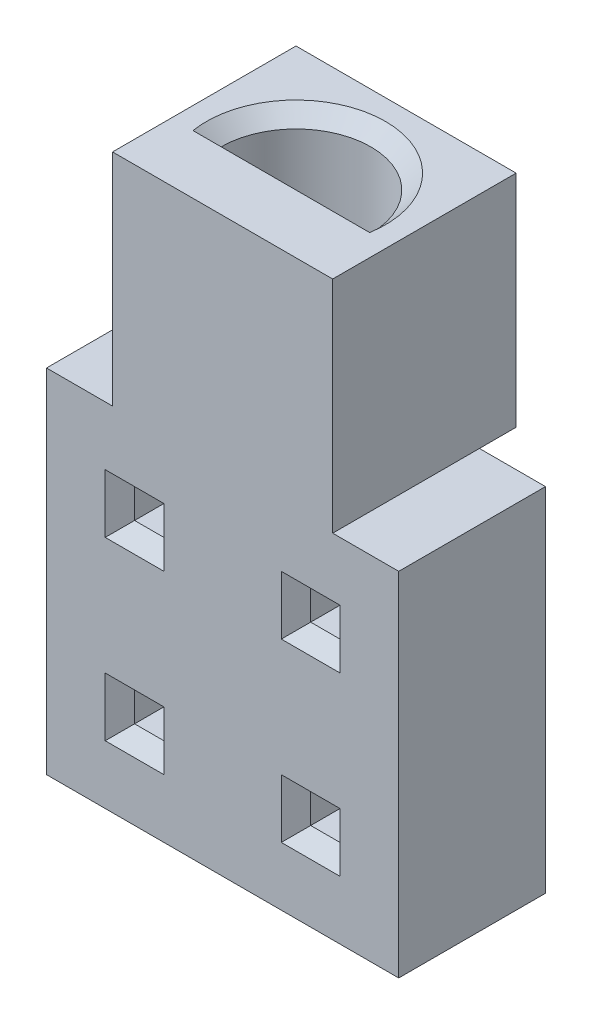
from build123d import *

# Parameters (mm, degrees)
AUFSATZ_LINEAR_AUSTRAGEN1_DEPTH      = 5
AUFSATZ_LINEAR_AUSTRAGEN1_DEPTH_BACK = 5
SKIZZE1_W                            = 24
SKIZZE1_H                            = 24
SKIZZE3_W                            = 15
SKIZZE3_H                            = 15
AUFSATZ_LINEAR_AUSTRAGEN2_DEPTH      = 15
SCHNITT_LINEAR_AUSTRAGEN1_DEPTH      = 10
FASE1_SIZE                           = 1
SCHNITT_LINEAR_START                 = -11
SKIZZE6_W                            = 2
SKIZZE6_H                            = 2
SCHNITT_LINEAR_AUSTRAGEN2_DEPTH      = 12
FASE2_SIZE                           = 1
SKIZZE12_W                           = 15
SKIZZE12_H                           = 15
SCHNITT_LINEAR_AUSTRAGEN4_DEPTH      = 2.5


with BuildPart() as part:
    # Skizze1 → Aufsatz-Linear austragen1 (new, two sides: drawn at the far end of the back side and taken through both)
    with BuildSketch(Plane.XY.offset(-AUFSATZ_LINEAR_AUSTRAGEN1_DEPTH_BACK)):
        Rectangle(SKIZZE1_W, SKIZZE1_H)
    extrude(amount=AUFSATZ_LINEAR_AUSTRAGEN1_DEPTH + AUFSATZ_LINEAR_AUSTRAGEN1_DEPTH_BACK)

    # Skizze3 → Aufsatz-Linear austragen2 (add)
    with BuildSketch(Plane(origin=(0, 12, 0), x_dir=(1, 0, 0), z_dir=(0, 1, 0))):
        Rectangle(SKIZZE3_W, SKIZZE3_H)
    extrude(amount=AUFSATZ_LINEAR_AUSTRAGEN2_DEPTH)

    # Skizze5 → Schnitt-Linear austragen1 (cut)
    with BuildSketch(Plane(origin=(0, 27, 0), x_dir=(1, 0, 0), z_dir=(0, 1, 0))):
        with BuildLine():
            Line((-5.1, 0), (5.1, 0))
            ThreePointArc((5.1, 0), (0, 5.1), (-5.1, 0))
        make_face()
    extrude(amount=-SCHNITT_LINEAR_AUSTRAGEN1_DEPTH, mode=Mode.SUBTRACT)

    # Fase1
    fase1_edges = [part.edges().sort_by_distance(p)[0] for p in [
        (0, 27, -5.1),
        (0, 27, 0),
    ]]
    chamfer(fase1_edges, length=FASE1_SIZE)

    # Skizze6 → Schnitt-Linear austragen2 (cut)
    with BuildSketch(Plane.XY.offset(-3).offset(SCHNITT_LINEAR_START)):
        with Locations((6, 6)):
            Rectangle(SKIZZE6_W, SKIZZE6_H)
        with Locations((6, -6)):
            Rectangle(SKIZZE6_W, SKIZZE6_H)
        with Locations((-6, -6)):
            Rectangle(SKIZZE6_W, SKIZZE6_H)
        with Locations((-6, 6)):
            Rectangle(SKIZZE6_W, SKIZZE6_H)
    schnitt_linear_austragen2 = extrude(amount=SCHNITT_LINEAR_AUSTRAGEN2_DEPTH, mode=Mode.SUBTRACT)

    # Spiegeln1: Schnitt-Linear austragen2 across plane
    add(schnitt_linear_austragen2.mirror(Plane.XY), mode=Mode.SUBTRACT)

    # Fase2
    fase2_edges = [part.edges().sort_by_distance(p)[0] for p in [
        (6, 5, 5),
        (7, 6, 5),
        (6, 7, 5),
        (5, 6, 5),
        (6, -7, 5),
        (7, -6, 5),
        (6, -5, 5),
        (5, -6, 5),
        (-6, -7, 5),
        (-5, -6, 5),
        (-6, -5, 5),
        (-7, -6, 5),
        (-6, 5, 5),
        (-5, 6, 5),
        (-6, 7, 5),
        (-7, 6, 5),
        (6, 7, -5),
        (7, 6, -5),
        (6, 5, -5),
        (5, 6, -5),
        (6, -5, -5),
        (7, -6, -5),
        (6, -7, -5),
        (5, -6, -5),
        (-6, -5, -5),
        (-5, -6, -5),
        (-6, -7, -5),
        (-7, -6, -5),
        (-6, 7, -5),
        (-5, 6, -5),
        (-6, 5, -5),
        (-7, 6, -5),
    ]]
    chamfer(fase2_edges, length=FASE2_SIZE)

    # Skizze12 → Schnitt-Linear austragen4 (cut)
    with BuildSketch(Plane.XY.offset(7.5)):
        with Locations((0, 19.5)):
            Rectangle(SKIZZE12_W, SKIZZE12_H)
    extrude(amount=-SCHNITT_LINEAR_AUSTRAGEN4_DEPTH, mode=Mode.SUBTRACT)


solid = part.part
